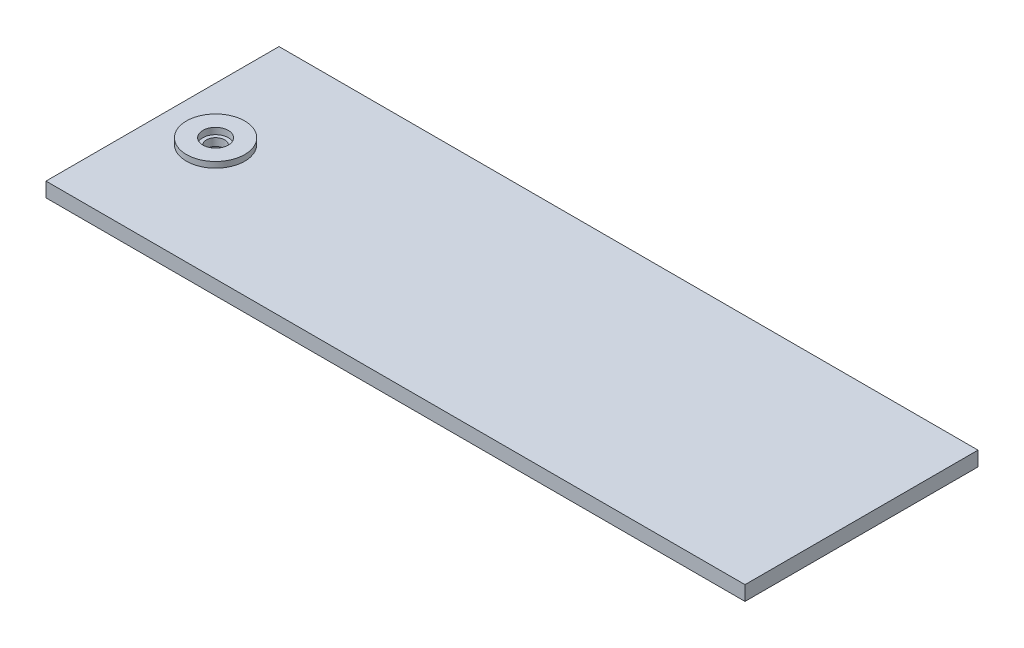
from build123d import *

# Parameters (mm, degrees)
SKETCH1_W           = 609.6
SKETCH1_H           = 203.2
BOSS_EXTRUDE1_DEPTH = 12.7
SKETCH2_R           = 25.4
BOSS_EXTRUDE3_DEPTH = 5.08
SKETCH9_R           = 11.1125
CUT_EXTRUDE4_DEPTH  = 5.55625
CUT_EXTRUDE5_START  = -5.55625
SKETCH10_R          = 11.1125
CUT_EXTRUDE5_DEPTH  = 5.55625
SKETCH11_R          = 7.9375
CUT_EXTRUDE6_DEPTH  = 322.519859517


with BuildPart() as part:
    # Sketch1 → Boss-Extrude1 (new body)
    with BuildSketch(Plane(origin=(0, 0, 0), x_dir=(1, 0, 0), z_dir=(0, 1, 0))):
        Rectangle(SKETCH1_W, SKETCH1_H)
    extrude(amount=BOSS_EXTRUDE1_DEPTH)

    # Sketch2 → Boss-Extrude3 (add)
    with BuildSketch(Plane(origin=(0, 12.7, 0), x_dir=(1, 0, 0), z_dir=(0, 1, 0))):
        with Locations(Location((-258.510557857, 0, 0), (0, 0, 90))):
            Circle(SKETCH2_R)
    extrude(amount=BOSS_EXTRUDE3_DEPTH)

    # Sketch9 → Cut-Extrude4 (cut)
    with BuildSketch(Plane(origin=(0, 17.78, 0), x_dir=(1, 0, 0), z_dir=(0, 1, 0))):
        with Locations(Location((-258.510557857, 0, 0), (0, 0, 270))):
            Circle(SKETCH9_R)
    extrude(amount=-CUT_EXTRUDE4_DEPTH, mode=Mode.SUBTRACT)

    # Sketch10 → Cut-Extrude5 (cut)
    with BuildSketch(Plane(origin=(0, 0, 0), x_dir=(-1, 0, 0), z_dir=(0, -1, 0)).offset(CUT_EXTRUDE5_START)):
        with Locations(Location((258.510557857, 0, 0), (0, 0, 270))):
            Circle(SKETCH10_R)
    extrude(amount=CUT_EXTRUDE5_DEPTH, mode=Mode.SUBTRACT)

    # Sketch11 → Cut-Extrude6 (cut, through all)
    with BuildSketch(Plane(origin=(0, 12.22375, 0), x_dir=(1, 0, 0), z_dir=(0, 1, 0))):
        with Locations(Location((-258.510557857, 0, 0), (0, 0, 270))):
            Circle(SKETCH11_R)
    extrude(amount=-CUT_EXTRUDE6_DEPTH, mode=Mode.SUBTRACT)


solid = part.part
